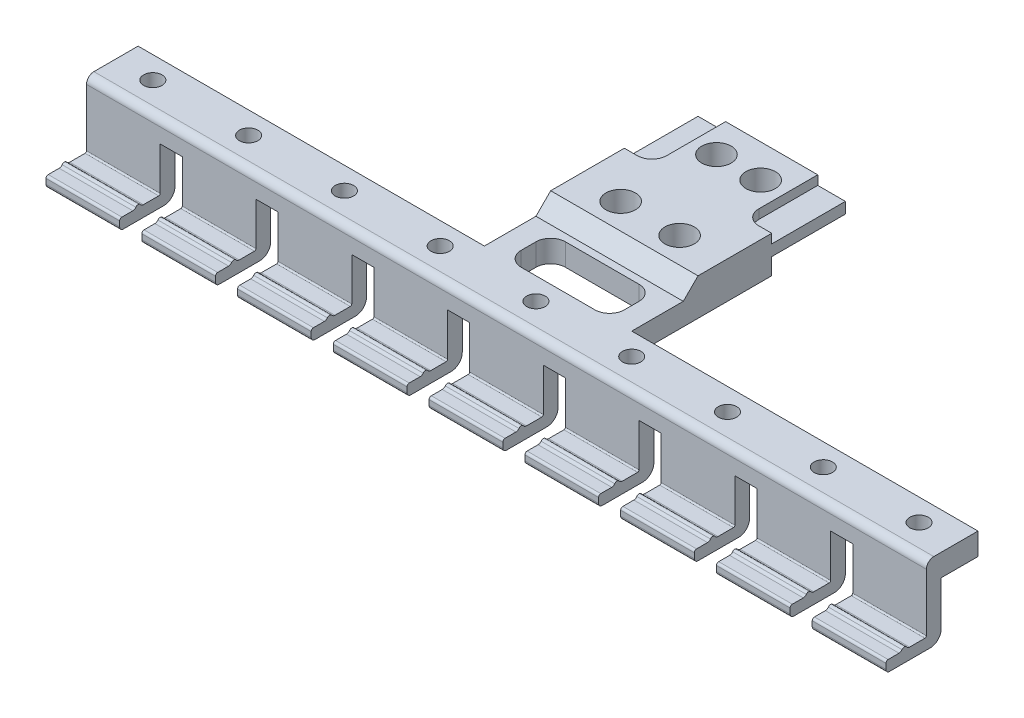
from build123d import *

# Parameters (mm, degrees)
SKETCH1_W                       = 114
SKETCH1_H                       = 6
BOSS_EXTRUDE1_DEPTH             = 4
SKETCH2_W                       = 20
SKETCH2_H                       = 6
BOSS_EXTRUDE2_DEPTH             = 22
BOSS_EXTRUDE3_DEPTH             = 10
SKETCH4_R                       = 2
CUT_EXTRUDE1_DEPTH              = 66.559133612
SKETCH8_R                       = 2
CUT_EXTRUDE3_DEPTH              = 66.642973729
SKETCH6_W                       = 14
SKETCH6_H                       = 6
CUT_EXTRUDE2_DEPTH              = 10
FILLET5_R                       = 2
CUT_EXTRUDE5_DEPTH              = 66.642973729
CUT_EXTRUDE5_DEPTH_BACK         = 66.642973729
BOSS_EXTRUDE5_REACH             = 67.643
SKETCH11_W                      = 3
SKETCH11_H                      = 3
BOSS_EXTRUDE5_DIRECTION_2_REACH = 67.643
BOSS_EXTRUDE4_DEPTH             = 10
FILLET10_R                      = 0.5
M3_TAPPED_HOLE1_D               = 2.5
LPATTERN1_COUNT                 = 9
LPATTERN1_PITCH                 = 13
FILLET10_OF_LPATTERN1_R         = 0.5
FILLET11_R                      = 1
FILLET12_R                      = 2


with BuildPart() as part:
    # Sketch1 → Boss-Extrude1 (new body)
    with BuildSketch(Plane.XY):
        with Locations((0, -3)):
            Rectangle(SKETCH1_W, SKETCH1_H)
    extrude(amount=BOSS_EXTRUDE1_DEPTH)

    # Sketch2 → Boss-Extrude2 (add)
    with BuildSketch(Plane.XY):
        with Locations((0, -3)):
            Rectangle(SKETCH2_W, SKETCH2_H)
    extrude(amount=-BOSS_EXTRUDE2_DEPTH)

    # Sketch3 → Boss-Extrude3 (add)
    with BuildSketch(Plane(origin=(0, 0, -22), x_dir=(-1, 0, 0), z_dir=(0, 0, -1))):
        Polygon((-6.25, -5), (6.25, -5), (6.25, -3.75), (10, -3.75), (10, -2.25), (6.25, -2.25), (6.25, -1), (-6.25, -1), (-6.25, -2.25), (-10, -2.25), (-10, -3.75), (-6.25, -3.75), align=None)
    extrude(amount=BOSS_EXTRUDE3_DEPTH)

    # Sketch4 → Cut-Extrude1 (cut, through all)
    with BuildSketch(Plane(origin=(0, -1, 0), x_dir=(1, 0, 0), z_dir=(0, 1, 0))):
        with Locations(Location((-3, 27.5, 0), (0, 0, 270))):
            Circle(SKETCH4_R)
        with Locations(Location((3, 27.5, 0), (0, 0, 270))):
            Circle(SKETCH4_R)
    extrude(amount=-CUT_EXTRUDE1_DEPTH, mode=Mode.SUBTRACT)

    # Sketch8 → Cut-Extrude3 (cut, through all)
    with BuildSketch(Plane(origin=(0, 0, 0), x_dir=(1, 0, 0), z_dir=(0, 1, 0))):
        with Locations(Location((-4, 15.5, 0), (0, 0, 270))):
            Circle(SKETCH8_R)
        with Locations(Location((4, 15.5, 0), (0, 0, 270))):
            Circle(SKETCH8_R)
    extrude(amount=-CUT_EXTRUDE3_DEPTH, mode=Mode.SUBTRACT)

    # Sketch6 → Cut-Extrude2 (cut)
    with BuildSketch(Plane(origin=(0, 0, 0), x_dir=(1, 0, 0), z_dir=(0, 1, 0))):
        with Locations((0, 6)):
            Rectangle(SKETCH6_W, SKETCH6_H)
    extrude(amount=-CUT_EXTRUDE2_DEPTH, mode=Mode.SUBTRACT)

    # Fillet5
    fillet5_edges = [part.edges().sort_by_distance(p)[0] for p in [
        (-7, -3, -3),
        (-7, -3, -9),
        (7, -3, -9),
        (7, -3, -3),
    ]]
    fillet(fillet5_edges, radius=FILLET5_R)

    # Sketch10 → Cut-Extrude5 (cut, two sides: drawn at the far end of the back side and taken through both)
    with BuildSketch(Plane(origin=(0, 0, 0), x_dir=(0, 0, -1), z_dir=(1, 0, 0)).offset(-CUT_EXTRUDE5_DEPTH_BACK)):
        Polygon((10, -3), (12, -1), (22, -1), (22, 0), (13, 0), (9.5, 0), (-4, 0), (-4, -3), align=None)
    extrude(amount=CUT_EXTRUDE5_DEPTH + CUT_EXTRUDE5_DEPTH_BACK, mode=Mode.SUBTRACT)

    # Boss-Extrude5: up to this face of the body (flat: up to its plane)
    boss_extrude5_end = Plane(part.part.faces().sort_by_distance((57, -4.5, 2))[0])
    # Sketch11 → Boss-Extrude5 (add, up to the picked face)
    with BuildSketch(Plane(origin=(0, 0, 0), x_dir=(0, 0, -1), z_dir=(1, 0, 0)), mode=Mode.PRIVATE) as boss_extrude5_sk1:
        with Locations((1.5, -4.5)):
            Rectangle(SKETCH11_W, SKETCH11_H)
    boss_extrude5_tool1 = split(extrude(boss_extrude5_sk1.sketch, amount=BOSS_EXTRUDE5_REACH, mode=Mode.PRIVATE), bisect_by=boss_extrude5_end, keep=Keep.BOTH, mode=Mode.PRIVATE)
    add(boss_extrude5_tool1.solids().sort_by(Axis((0, -4.5, -1.5), (1, 0, 0)))[0])

    # Boss-Extrude5 direction 2: up to this face of the body (flat: up to its plane)
    boss_extrude5_direction_2_end = Plane(part.part.faces().sort_by_distance((-57, -4.5, 2))[0])
    # Sketch11 → Boss-Extrude5 direction 2 (add, up to the picked face)
    with BuildSketch(Plane(origin=(0, 0, 0), x_dir=(0, 0, -1), z_dir=(1, 0, 0)), mode=Mode.PRIVATE) as boss_extrude5_direction_2_sk1:
        with Locations((1.5, -4.5)):
            Rectangle(SKETCH11_W, SKETCH11_H)
    boss_extrude5_direction_2_tool1 = split(extrude(boss_extrude5_direction_2_sk1.sketch, amount=-BOSS_EXTRUDE5_DIRECTION_2_REACH, mode=Mode.PRIVATE), bisect_by=boss_extrude5_direction_2_end, keep=Keep.BOTH, mode=Mode.PRIVATE)
    add(boss_extrude5_direction_2_tool1.solids().sort_by(Axis((0, -4.5, -1.5), (-1, 0, 0)))[0])

    # Sketch5 → Boss-Extrude4 (add)
    with BuildSketch(Plane.ZY.offset(57)):
        with BuildLine():
            Line((3.5, -13.5), (9, -13.5))
            ThreePointArc((9, -13.5), (9.353553391, -13.353553391), (9.5, -13))
            Line((9.5, -13), (9.5, -12.3))
            ThreePointArc((9.5, -12.3), (9.412132034, -12.087867966), (9.2, -12))
            Line((9.2, -12), (7.375, -12))
            ThreePointArc((7.375, -12), (7, -11.625), (6.625, -12))
            Line((6.625, -12), (4.2, -12))
            ThreePointArc((4.2, -12), (4.058578644, -11.941421356), (4, -11.8))
            Line((4, -11.8), (4, -6))
            Line((4, -6), (2, -6))
            Line((2, -6), (2, -12))
            ThreePointArc((2, -12), (2.439339828, -13.060660172), (3.5, -13.5))
        make_face()
    boss_extrude4 = extrude(amount=-BOSS_EXTRUDE4_DEPTH)

    # Fillet10
    fillet10_edges = [part.edges().sort_by_distance(p)[0] for p in [
        (-52, -12, 6.625),
        (-52, -12, 7.375),
    ]]
    fillet(fillet10_edges, radius=FILLET10_R)

    # M3 Tapped Hole1 (through all)
    with Locations(Plane(origin=(0, -3, 0), x_dir=(1, 0, 0), z_dir=(0, 1, 0))):
        with Locations((-52, 0)):
            m3_tapped_hole1 = Hole(M3_TAPPED_HOLE1_D / 2)

    # LPattern1: Boss-Extrude4, M3 Tapped Hole1 ×9
    with Locations(*[(i * LPATTERN1_PITCH, 0, 0) for i in range(1, LPATTERN1_COUNT)]):
        add(boss_extrude4)
        add(m3_tapped_hole1, mode=Mode.SUBTRACT)

    # Fillet10 of LPattern1
    fillet10_of_lpattern1_edges = [part.edges().sort_by_distance(p)[0] for p in [
        (-39, -12, 6.625),
        (-39, -12, 7.375),
        (-26, -12, 6.625),
        (-26, -12, 7.375),
        (-13, -12, 6.625),
        (-13, -12, 7.375),
        (0, -12, 6.625),
        (0, -12, 7.375),
        (13, -12, 6.625),
        (13, -12, 7.375),
        (26, -12, 6.625),
        (26, -12, 7.375),
        (39, -12, 6.625),
        (39, -12, 7.375),
        (52, -12, 6.625),
        (52, -12, 7.375),
    ]]
    fillet(fillet10_of_lpattern1_edges, radius=FILLET10_OF_LPATTERN1_R)

    # Fillet11
    fillet11_edges = [part.edges().sort_by_distance(p)[0] for p in [
        (0, -3, 4),
    ]]
    fillet(fillet11_edges, radius=FILLET11_R)

    # Fillet12
    fillet12_edges = [part.edges().sort_by_distance(p)[0] for p in [
        (-6.25, -4.375, -22),
        (-6.25, -1.625, -22),
        (6.25, -1.625, -22),
        (6.25, -4.375, -22),
    ]]
    fillet(fillet12_edges, radius=FILLET12_R)


solid = part.part
